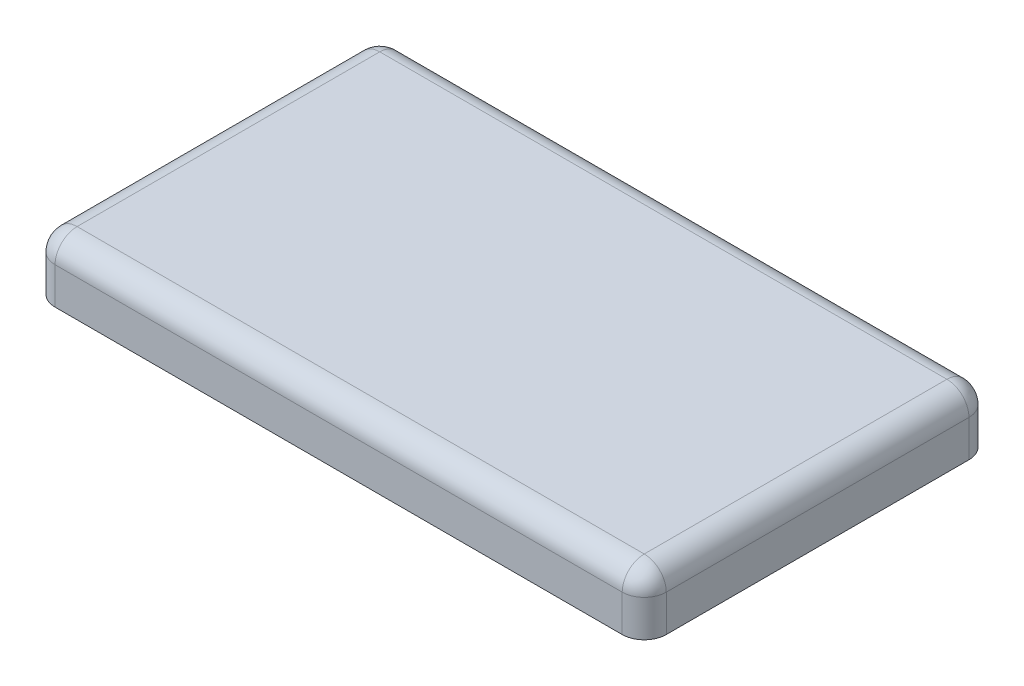
from build123d import *

# Parameters (mm, degrees)
SKETCH1_W           = 41.6
SKETCH1_H           = 23.6
BOSS_EXTRUDE1_DEPTH = 4
SKETCH2_W           = 38.9
SKETCH2_H           = 20.9
CUT_EXTRUDE1_DEPTH  = 2.6
FILLET1_R           = 1.5


with BuildPart() as part:
    # Sketch1 → Boss-Extrude1 (new body)
    with BuildSketch(Plane(origin=(0, 0, 0), x_dir=(1, 0, 0), z_dir=(0, 1, 0))):
        with Locations((20.8, 11.8)):
            Rectangle(SKETCH1_W, SKETCH1_H)
    extrude(amount=BOSS_EXTRUDE1_DEPTH)

    # Sketch2 → Cut-Extrude1 (cut)
    with BuildSketch(Plane.XZ):
        with Locations((20.8, -11.8)):
            Rectangle(SKETCH2_W, SKETCH2_H)
    extrude(amount=-CUT_EXTRUDE1_DEPTH, mode=Mode.SUBTRACT)

    # Fillet1
    fillet1_edges = [part.edges().sort_by_distance(p)[0] for p in [
        (41.6, 4, -11.8),
        (20.8, 4, -23.6),
        (0, 4, -11.8),
        (20.8, 4, 0),
        (0, 2, -23.6),
        (41.6, 2, -23.6),
        (41.6, 2, 0),
        (0, 2, 0),
    ]]
    fillet(fillet1_edges, radius=FILLET1_R)


solid = part.part
